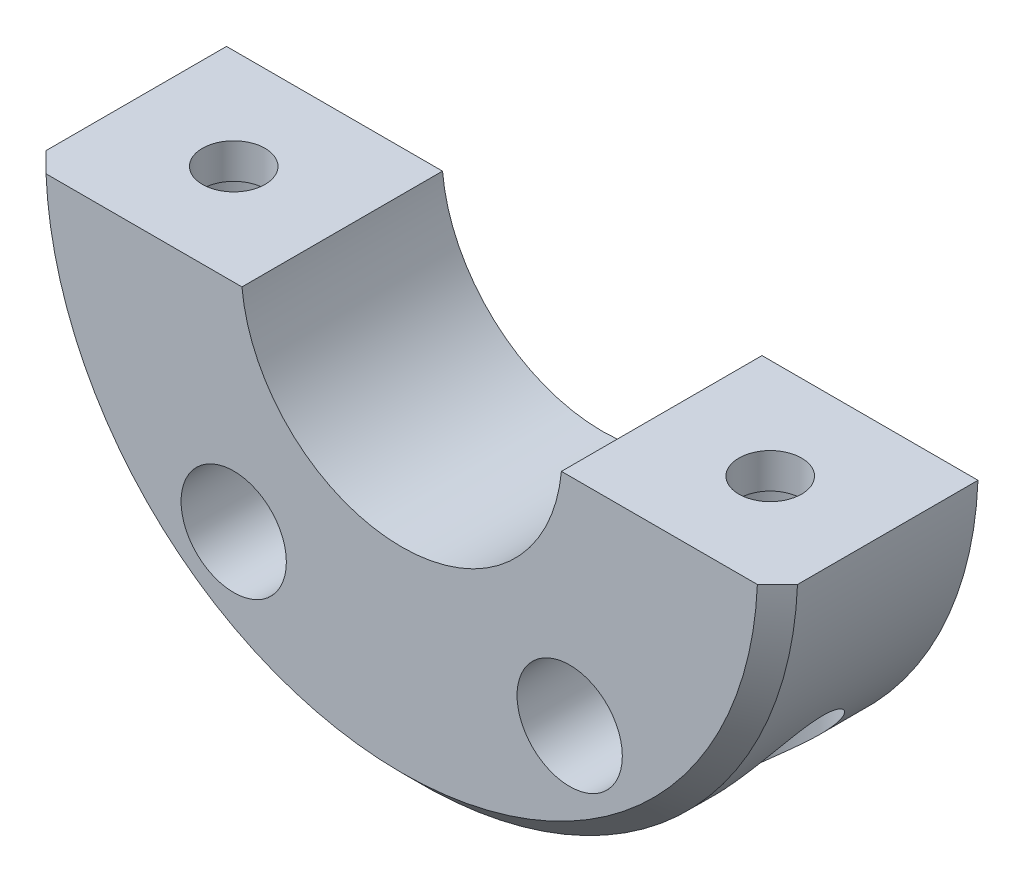
from build123d import *

# Parameters (mm, degrees)
BOSS_EXTRUDE1_DEPTH = 20
SKETCH2_R           = 5.25
CUT_EXTRUDE1_DEPTH  = 30
SKETCH3_R           = 3.125
CUT_EXTRUDE2_DEPTH  = 30
SKETCH4_R           = 5.25
CUT_EXTRUDE3_DEPTH  = 33
CHAMFER1_SIZE       = 2
SKETCH5_W           = 75
SKETCH5_H           = 20
CUT_EXTRUDE4_DEPTH  = 1.5


with BuildPart() as part:
    # Sketch1 → Boss-Extrude1 (new body)
    with BuildSketch(Plane.XY):
        with BuildLine():
            Line((-16, 0), (-37.5, 0))
            ThreePointArc((-37.5, 0), (0, -37.5), (37.5, 0))
            Line((37.5, 0), (16, 0))
            ThreePointArc((16, 0), (0, -16), (-16, 0))
        make_face()
    extrude(amount=BOSS_EXTRUDE1_DEPTH)

    # Sketch2 → Cut-Extrude1 (cut)
    with BuildSketch(Plane.XY.offset(20)):
        with Locations((-16.75187969, -23.05698434)):
            Circle(SKETCH2_R)
        with Locations((16.75187969, -23.05698434)):
            Circle(SKETCH2_R)
    extrude(amount=-CUT_EXTRUDE1_DEPTH, mode=Mode.SUBTRACT)

    # Sketch3 → Cut-Extrude2 (cut)
    with BuildSketch(Plane(origin=(0, 0, 0), x_dir=(1, 0, 0), z_dir=(0, 1, 0))):
        with Locations(Location((-26.75, -10, 0), (0, 0, 270))):
            Circle(SKETCH3_R)
        with Locations(Location((26.75, -10, 0), (0, 0, 270))):
            Circle(SKETCH3_R)
    extrude(amount=-CUT_EXTRUDE2_DEPTH, mode=Mode.SUBTRACT)

    # Sketch4 → Cut-Extrude3 (cut)
    with BuildSketch(Plane(origin=(0, -38, 0), x_dir=(1, 0, 0), z_dir=(0, 1, 0))):
        with Locations(Location((-26.75, -10, 0), (0, 0, 90))):
            Circle(SKETCH4_R)
        with Locations(Location((26.75, -10, 0), (0, 0, 90))):
            Circle(SKETCH4_R)
    extrude(amount=CUT_EXTRUDE3_DEPTH, mode=Mode.SUBTRACT)

    # Chamfer1
    chamfer1_edges = [part.edges().sort_by_distance(p)[0] for p in [
        (0, -37.5, 20),
    ]]
    chamfer(chamfer1_edges, length=CHAMFER1_SIZE)

    # Sketch5 → Cut-Extrude4 (cut)
    with BuildSketch(Plane(origin=(0, 0, 0), x_dir=(1, 0, 0), z_dir=(0, 1, 0))):
        with Locations((0, -10)):
            Rectangle(SKETCH5_W, SKETCH5_H)
    extrude(amount=-CUT_EXTRUDE4_DEPTH, mode=Mode.SUBTRACT)


solid = part.part
